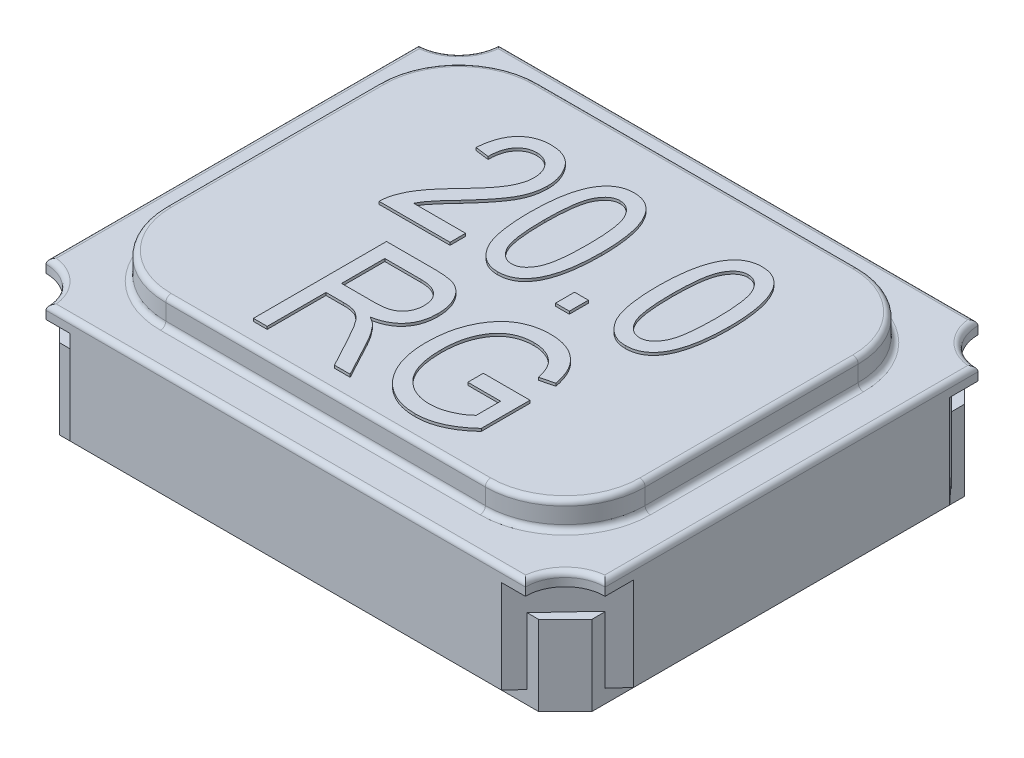
from build123d import *

# Parameters (mm, degrees)
EXTRUDE_2_DEPTH   = 0.05
EXTRUDE_2_2_DEPTH = 0.05
EXTRUDE_2_3_DEPTH = 0.05
EXTRUDE_2_4_DEPTH = 0.05
EXTRUDE_4_DEPTH   = 0.25
EXTRUDE_6_DEPTH   = 0.35
EXTRUDE_9_DEPTH   = 0.05
SKETCH_6_W        = 1.8
SKETCH_6_H        = 1.4
EXTRUDE_10_DEPTH  = 0.1
FILLET_2_R        = 0.3
FILLET_3_R        = 0.02
SKETCH_7_W        = 0.051948052
SKETCH_7_H        = 0.071428571
EXTRUDE_11_DEPTH  = 0.01


with BuildPart() as part:
    # Эскиз2 → Вытянуть2 (new body)
    with BuildSketch(Plane(origin=(0, 0, 0), x_dir=(1, 0, 0), z_dir=(0, 1, 0))):
        Polygon((-1, 0.25), (-0.35, 0.25), (-0.35, 0.8), (-0.9, 0.8), (-1, 0.7), align=None)
    extrude(amount=EXTRUDE_2_DEPTH)



with BuildPart() as body_2:
    # Эскиз2 → Extrude 2 2 (new body)
    with BuildSketch(Plane(origin=(0, 0, 0), x_dir=(1, 0, 0), z_dir=(0, 1, 0))):
        Polygon((0.35, 0.25), (0.35, 0.8), (0.9, 0.8), (1, 0.7), (1, 0.25), align=None)
    extrude(amount=EXTRUDE_2_2_DEPTH)


with BuildPart() as body_3:
    # Эскиз2 → Extrude 2 3 (new body)
    with BuildSketch(Plane(origin=(0, 0, 0), x_dir=(1, 0, 0), z_dir=(0, 1, 0))):
        Polygon((-1, -0.7), (-1, -0.25), (-0.484, -0.25), (-0.35, -0.363384615), (-0.35, -0.8), (-0.9, -0.8), align=None)
    extrude(amount=EXTRUDE_2_3_DEPTH)


with BuildPart() as body_4:
    # Эскиз2 → Extrude 2 4 (new body)
    with BuildSketch(Plane(origin=(0, 0, 0), x_dir=(1, 0, 0), z_dir=(0, 1, 0))):
        Polygon((1, -0.25), (0.35, -0.25), (0.35, -0.8), (0.9, -0.8), (1, -0.7), align=None)
    extrude(amount=EXTRUDE_2_4_DEPTH)


with BuildPart() as part_1:
    add(part.part)

    add(body_2.part)  # Вытянуть4 merges body 2

    add(body_3.part)  # Вытянуть4 merges body 3

    add(body_4.part)  # Вытянуть4 merges body 4
    # Эскиз3 → Вытянуть4 (add)
    with BuildSketch(Plane(origin=(-0.35, 0.05, 0.8), x_dir=(-1, 0, 0), z_dir=(0, 1, 0))):
        Polygon((0.65, -1.5), (0.55, -1.6), (0.5, -1.6), (0.65, -1.45), align=None)
        Polygon((-1.35, -1.45), (-1.35, -1.5), (-1.25, -1.6), (-1.2, -1.6), align=None)
        Polygon((-1.35, -0.1), (-1.25, 0), (-1.2, 0), (-1.35, -0.15), align=None)
        Polygon((0.65, -0.15), (0.65, -0.1), (0.55, 0), (0.5, 0), align=None)
    extrude(amount=EXTRUDE_4_DEPTH)


with BuildPart() as body_2_2:
    # Эскиз4 → Вытянуть6 (new body)
    with BuildSketch(Plane(origin=(-0.35, 0.05, 0.8), x_dir=(-1, 0, 0), z_dir=(0, 1, 0))):
        Polygon((0.46, -1.65), (-1.16, -1.65), (-1.4, -1.393609781), (-1.4, -0.206390219), (-1.16, 0.05), (0.46, 0.05), (0.7, -0.206390219), (0.7, -1.393609781), align=None)
    extrude(amount=EXTRUDE_6_DEPTH)

    # Эскиз5 → Вытянуть9 (add)
    with BuildSketch(Plane(origin=(0, 0.4, 0.85), x_dir=(-1, 0, 0), z_dir=(0, 1, 0))):
        with BuildLine():
            Line((0.9, -1.7), (-0.9, -1.7))
            ThreePointArc((-0.9, -1.7), (-0.943933983, -1.593933983), (-1.05, -1.55))
            Line((-1.05, -1.55), (-1.05, -0.15))
            ThreePointArc((-1.05, -0.15), (-0.943933983, -0.106066017), (-0.9, 0))
            Line((-0.9, 0), (0.9, 0))
            ThreePointArc((0.9, 0), (0.943933983, -0.106066017), (1.05, -0.15))
            Line((1.05, -0.15), (1.05, -1.55))
            ThreePointArc((1.05, -1.55), (0.943933983, -1.593933983), (0.9, -1.7))
        make_face()
    extrude(amount=EXTRUDE_9_DEPTH)

    # Эскиз6 → Вытянуть10 (add)
    with BuildSketch(Plane(origin=(0, 0.45, 0), x_dir=(1, 0, 0), z_dir=(0, 1, 0))):
        Rectangle(SKETCH_6_W, SKETCH_6_H)
    extrude(amount=EXTRUDE_10_DEPTH)

    # Скругление2
    fillet_2_edges = [body_2_2.edges().sort_by_distance(p)[0] for p in [
        (-0.9, 0.5, -0.7),
        (-0.9, 0.5, 0.7),
        (0.9, 0.5, 0.7),
        (0.9, 0.5, -0.7),
    ]]
    fillet(fillet_2_edges, radius=FILLET_2_R)

    # Скругление3
    fillet_3_edges = [body_2_2.edges().sort_by_distance(p)[0] for p in [
        (-0.943933983, 0.45, 0.743933983),
        (0, 0.45, 0.85),
        (0.943933983, 0.45, 0.743933983),
        (1.05, 0.45, 0),
        (0.943933983, 0.45, -0.743933983),
        (0, 0.45, -0.85),
        (-0.943933983, 0.45, -0.743933983),
        (-1.05, 0.45, 0),
        (0, 0.45, -0.7),
        (0, 0.55, -0.7),
        (0.9, 0.45, 0),
        (0.9, 0.55, 0),
        (-0.9, 0.55, 0),
        (0, 0.55, 0.7),
        (-0.812132034, 0.55, 0.612132034),
        (-0.812132034, 0.55, -0.612132034),
        (0.812132034, 0.55, 0.612132034),
        (0.812132034, 0.55, -0.612132034),
        (0, 0.45, 0.7),
        (-0.9, 0.45, 0),
        (0.812132034, 0.45, -0.612132034),
        (0.812132034, 0.45, 0.612132034),
        (-0.812132034, 0.45, -0.612132034),
        (-0.812132034, 0.45, 0.612132034),
    ]]
    fillet(fillet_3_edges, radius=FILLET_3_R)

    # Эскиз7 → Вытянуть11 (add)
    # profile 1 of 6: a face of its own
    with BuildSketch(Plane(origin=(0, 0.55, 0), x_dir=(-1, 0, 0), z_dir=(0, 1, 0))):
        with BuildLine():
            Line((0.232671519, -0.058441558), (0.232671519, 0))
            Line((0.232671519, 0), (0.498905285, 0))
            add(Edge.make_bspline(
                [(0.498905285, 0), (0.498917612, -0.00304505), (0.498942586, -0.00921437), (0.49811227, -0.018620044), (0.496406314, -0.028253434), (0.494227981, -0.038243051), (0.491139349, -0.048457517), (0.487358262, -0.058946435), (0.482897028, -0.069683799), (0.477672865, -0.080732774), (0.471570065, -0.092201076), (0.464197802, -0.104033552), (0.455773301, -0.11645002), (0.446092454, -0.129295645), (0.435329427, -0.142692521), (0.423431106, -0.156578601), (0.410447182, -0.171030183), (0.401194672, -0.180628905), (0.396429636, -0.18557224)],
                knots=[0, 0, 0, 0, 0.672196011, 1.361880106, 2.081368845, 2.831486093, 3.618364569, 4.435734711, 5.292876118, 6.184871288, 7.133796945, 8.159796293, 9.26180684, 10.446293416, 11.710635831, 13.056147575, 14.483918136, 16, 16, 16, 16], degree=3))
            add(Edge.make_bspline(
                [(0.396429636, -0.18557224), (0.390892589, -0.191298767), (0.380231437, -0.20232475), (0.365232169, -0.218609445), (0.351585097, -0.233731191), (0.33963091, -0.248043769), (0.328917483, -0.261113943), (0.319849175, -0.273362766), (0.312230175, -0.284547289), (0.304203757, -0.297877238), (0.29646293, -0.31365476), (0.289833046, -0.332138627), (0.285407707, -0.349934345), (0.284877169, -0.361685004), (0.284619571, -0.367390422)],
                knots=[0, 0, 0, 0, 1.312411154, 2.526945595, 3.64776648, 4.668054202, 5.599250703, 6.431783916, 7.178281792, 7.828133401, 8.994463432, 10.06613924, 11.061032878, 12, 12, 12, 12], degree=3))
            add(Edge.make_bspline(
                [(0.284619571, -0.367390422), (0.284654675, -0.370540165), (0.284723237, -0.376691941), (0.285941625, -0.385669869), (0.287601636, -0.394241654), (0.290070092, -0.402340236), (0.29307985, -0.410071276), (0.297008451, -0.417248033), (0.301435, -0.424103497), (0.30662006, -0.430356937), (0.312282721, -0.43600005), (0.318266049, -0.441051519), (0.324669369, -0.445180494), (0.331361117, -0.448600611), (0.338381281, -0.451217493), (0.345712151, -0.453178261), (0.353376168, -0.454292181), (0.358581229, -0.454460193), (0.361222655, -0.454545455)],
                knots=[0, 0, 0, 0, 1.164230772, 2.273864494, 3.346188882, 4.391230338, 5.401926325, 6.409519631, 7.412440917, 8.416921958, 9.407829897, 10.36743554, 11.307926244, 12.220023309, 13.142615873, 14.07432652, 15.022773578, 16, 16, 16, 16], degree=3))
            add(Edge.make_bspline(
                [(0.361222655, -0.454545455), (0.364070576, -0.454485797), (0.369629849, -0.454369343), (0.377731994, -0.452918788), (0.385498639, -0.450984378), (0.392832144, -0.447978086), (0.399826512, -0.444195094), (0.406371091, -0.439528792), (0.412563112, -0.434056502), (0.41831312, -0.427772385), (0.423615073, -0.420724905), (0.428046819, -0.412793843), (0.431962859, -0.404233322), (0.435043369, -0.39489877), (0.437518278, -0.384860919), (0.439155639, -0.374093936), (0.440361632, -0.362615034), (0.440429069, -0.354711267), (0.440463727, -0.350649351)],
                knots=[0, 0, 0, 0, 0.928796924, 1.81305423, 2.681021375, 3.538312184, 4.39332334, 5.272808506, 6.156996835, 7.087171748, 8.050270225, 9.029757968, 10.048018956, 11.120254801, 12.234609712, 13.420296851, 14.674234959, 16, 16, 16, 16], degree=3))
            Line((0.440463727, -0.350649351), (0.492411779, -0.357142857))
            add(Edge.make_bspline(
                [(0.492411779, -0.357142857), (0.49187644, -0.363171023), (0.490837859, -0.374865938), (0.488112699, -0.391796024), (0.484331799, -0.407504545), (0.479841157, -0.42214625), (0.474200113, -0.435546182), (0.467851001, -0.447949676), (0.46042633, -0.45914099), (0.452081119, -0.469138882), (0.442885298, -0.47790569), (0.433006074, -0.485525178), (0.422489934, -0.492133469), (0.411188866, -0.497379056), (0.399177627, -0.501469163), (0.386500985, -0.504393413), (0.373108184, -0.506137389), (0.363967338, -0.506373047), (0.359294896, -0.506493506)],
                knots=[0, 0, 0, 0, 1.296016433, 2.514330702, 3.668705393, 4.754684394, 5.790583066, 6.778804856, 7.735156204, 8.660808185, 9.562568342, 10.450784178, 11.329227516, 12.217177451, 13.112894374, 14.042449809, 14.999377131, 16, 16, 16, 16], degree=3))
            add(Edge.make_bspline(
                [(0.359294896, -0.506493506), (0.354249699, -0.506346514), (0.344425863, -0.506060296), (0.33013219, -0.504145282), (0.316760971, -0.500844453), (0.304409121, -0.49599124), (0.292942356, -0.49003096), (0.282464384, -0.48262852), (0.272986119, -0.473828195), (0.264558803, -0.463796511), (0.257109134, -0.452970885), (0.250609353, -0.44164975), (0.244971173, -0.430022221), (0.240564811, -0.41795851), (0.236885019, -0.405620629), (0.234573296, -0.392821522), (0.232945859, -0.379708876), (0.232763482, -0.370845267), (0.232671519, -0.366375812)],
                knots=[0, 0, 0, 0, 1.141316638, 2.222333051, 3.255980828, 4.24919085, 5.217781249, 6.173073686, 7.14226832, 8.135684626, 9.131102602, 10.111468148, 11.086834621, 12.050425614, 13.014198859, 13.995608887, 14.989290351, 16, 16, 16, 16], degree=3))
            add(Edge.make_bspline(
                [(0.232671519, -0.366375812), (0.232757917, -0.36234895), (0.232929586, -0.354347691), (0.234053205, -0.342410744), (0.236016172, -0.330628762), (0.238633429, -0.318924457), (0.242077357, -0.307358632), (0.246390642, -0.295967255), (0.251372193, -0.284690069), (0.257142514, -0.273311282), (0.264092567, -0.261579793), (0.272343802, -0.249103288), (0.282017543, -0.23574705), (0.292992876, -0.221446855), (0.305286603, -0.206205919), (0.319006401, -0.190085058), (0.334125017, -0.17306482), (0.344767389, -0.161509067), (0.350264863, -0.155539773)],
                knots=[0, 0, 0, 0, 0.780472836, 1.550777384, 2.321277132, 3.094115446, 3.873899828, 4.657970281, 5.45330333, 6.262401287, 7.129160449, 8.094534006, 9.160566029, 10.324774858, 11.58803391, 12.955259569, 14.427194379, 16, 16, 16, 16], degree=3))
            add(Edge.make_bspline(
                [(0.350264863, -0.155539773), (0.353758377, -0.151828815), (0.360434764, -0.144736877), (0.36982518, -0.134449828), (0.378429997, -0.125224118), (0.385956729, -0.116826206), (0.392649779, -0.109435964), (0.398151375, -0.102811532), (0.402881809, -0.097275637), (0.409782828, -0.088404781), (0.418492158, -0.075892041), (0.424550928, -0.06412424), (0.427476714, -0.058441558)],
                knots=[0, 0, 0, 0, 1.227426371, 2.345710398, 3.354421158, 4.265580894, 5.061720194, 5.755250507, 6.339260457, 6.815034732, 8.461977265, 10, 10, 10, 10], degree=3))
            Line((0.427476714, -0.058441558), (0.232671519, -0.058441558))
        make_face()
    # profile 2 of 6: a face of its own
    with BuildSketch(Plane(origin=(0, 0.55, 0), x_dir=(-1, 0, 0), z_dir=(0, 1, 0))):
        with BuildLine():
            add(Edge.make_bspline(
                [(0.180723467, -0.249797078), (0.180640986, -0.260013151), (0.180480827, -0.279850309), (0.178825266, -0.308621794), (0.176214676, -0.335500992), (0.17266229, -0.360450794), (0.167862398, -0.383478546), (0.162176423, -0.404639838), (0.155274645, -0.423875391), (0.147415171, -0.441200763), (0.138496632, -0.456548565), (0.128488856, -0.469870509), (0.117535364, -0.48127606), (0.105411725, -0.490529621), (0.092303491, -0.497705198), (0.07818326, -0.502835572), (0.063062408, -0.505939473), (0.052626772, -0.506306327), (0.047302201, -0.506493506)],
                knots=[0, 0, 0, 0, 1.522177082, 2.955701814, 4.292601031, 5.54555501, 6.7088804, 7.795771162, 8.808034672, 9.750647735, 10.627079958, 11.44753433, 12.228026558, 12.97593222, 13.711165822, 14.446140298, 15.20717461, 16, 16, 16, 16], degree=3))
            add(Edge.make_bspline(
                [(0.047302201, -0.506493506), (0.042554112, -0.506356036), (0.033223818, -0.506085899), (0.019676077, -0.503410961), (0.006829687, -0.499423323), (-0.005128517, -0.493538576), (-0.016333839, -0.48604567), (-0.026653133, -0.476828075), (-0.036353411, -0.46608203), (-0.041876669, -0.457933128), (-0.044722962, -0.453733766)],
                knots=[0, 0, 0, 0, 1.02455918, 2.013323352, 2.972239719, 3.92313388, 4.881632631, 5.875512573, 6.905191138, 8, 8, 8, 8], degree=3))
            add(Edge.make_bspline(
                [(-0.044722962, -0.453733766), (-0.048028121, -0.448082969), (-0.05490155, -0.436331541), (-0.063093018, -0.416638601), (-0.070075917, -0.394635791), (-0.07565398, -0.370218052), (-0.080075893, -0.343482261), (-0.083285648, -0.314391147), (-0.085214361, -0.282899748), (-0.085409287, -0.261095938), (-0.085510299, -0.249797078)],
                knots=[0, 0, 0, 0, 0.745775943, 1.550919754, 2.425386613, 3.375801173, 4.404149056, 5.513981972, 6.711731112, 8, 8, 8, 8], degree=3))
            add(Edge.make_bspline(
                [(-0.085510299, -0.249797078), (-0.085428567, -0.239648513), (-0.085269894, -0.219946282), (-0.083603146, -0.191345463), (-0.081017425, -0.164596819), (-0.077394399, -0.139736653), (-0.072811074, -0.11673598), (-0.06700422, -0.095661638), (-0.060297185, -0.076405623), (-0.052374339, -0.059083715), (-0.043478563, -0.043668697), (-0.033550189, -0.030232427), (-0.022451615, -0.018942998), (-0.010443927, -0.00954879), (0.002759204, -0.002404921), (0.016876914, 0.002848039), (0.032084913, 0.005940777), (0.042553196, 0.006306385), (0.047910967, 0.006493506)],
                knots=[0, 0, 0, 0, 1.513837482, 2.938935398, 4.272350439, 5.521752746, 6.68539866, 7.768673685, 8.780403913, 9.72410058, 10.605895827, 11.431327849, 12.209109083, 12.960945015, 13.697023823, 14.439318735, 15.201227913, 16, 16, 16, 16], degree=3))
            add(Edge.make_bspline(
                [(0.047910967, 0.006493506), (0.052690424, 0.006312367), (0.062087376, 0.005956227), (0.075856407, 0.003304879), (0.088868573, -0.001404232), (0.101336743, -0.007642189), (0.112961271, -0.015954685), (0.124054532, -0.025838873), (0.134218964, -0.037768208), (0.144036478, -0.051337354), (0.152793354, -0.067253597), (0.160377584, -0.085663078), (0.1667005, -0.106676674), (0.17178576, -0.130303922), (0.175777874, -0.156499133), (0.178692058, -0.185280282), (0.180378593, -0.216666701), (0.180605506, -0.238465164), (0.180723467, -0.249797078)],
                knots=[0, 0, 0, 0, 0.713939269, 1.403684939, 2.084525483, 2.776045801, 3.479790818, 4.213328499, 4.990539752, 5.816442109, 6.712155869, 7.697513436, 8.78604652, 9.986360954, 11.305640346, 12.743160741, 14.306934742, 16, 16, 16, 16], degree=3))
        make_face()
        with BuildLine():
            add(Edge.make_bspline(
                [(0.128775415, -0.25), (0.128683823, -0.240259105), (0.128508536, -0.221617308), (0.127569462, -0.194913542), (0.12575582, -0.170748876), (0.123272565, -0.149074759), (0.120081146, -0.129892578), (0.116234898, -0.113164193), (0.111515106, -0.098988345), (0.106075208, -0.087117323), (0.099950488, -0.077255722), (0.093575592, -0.068752941), (0.086757501, -0.061562079), (0.079476194, -0.05571324), (0.071827452, -0.051057517), (0.063709867, -0.047784602), (0.055179529, -0.045769006), (0.049342463, -0.045560197), (0.046389051, -0.045454545)],
                knots=[0, 0, 0, 0, 1.930680258, 3.694870612, 5.294765573, 6.732327541, 8.017244644, 9.14720992, 10.130763445, 10.973463911, 11.728776188, 12.427251247, 13.076760965, 13.687074849, 14.273357039, 14.844695938, 15.415444712, 16, 16, 16, 16], degree=3))
            add(Edge.make_bspline(
                [(0.046389051, -0.045454545), (0.04360127, -0.045550442), (0.038050352, -0.045741386), (0.029962995, -0.047942697), (0.022176254, -0.051131009), (0.014831053, -0.055880545), (0.007870115, -0.0618819), (0.001230526, -0.069196898), (-0.005051211, -0.077765836), (-0.011039403, -0.087762618), (-0.016537305, -0.099677068), (-0.021060805, -0.11397351), (-0.025004676, -0.130656093), (-0.028016434, -0.149798316), (-0.030557272, -0.171354802), (-0.032348897, -0.195387848), (-0.033296147, -0.22188756), (-0.033471004, -0.240360473), (-0.033562247, -0.25)],
                knots=[0, 0, 0, 0, 0.5561996, 1.107481919, 1.665324653, 2.233973471, 2.848122302, 3.499305928, 4.205575626, 4.970121907, 5.826722289, 6.823612291, 7.963984009, 9.252947287, 10.697030014, 12.304913753, 14.07183163, 16, 16, 16, 16], degree=3))
            add(Edge.make_bspline(
                [(-0.033562247, -0.25), (-0.033469883, -0.259740853), (-0.033292799, -0.278416363), (-0.032361359, -0.305154447), (-0.030534526, -0.32938541), (-0.0280685, -0.351095568), (-0.02486641, -0.37030971), (-0.021024447, -0.387040439), (-0.016294185, -0.401209465), (-0.010897308, -0.41307476), (-0.004694761, -0.422849766), (0.00159717, -0.431384203), (0.008597034, -0.438442005), (0.01592366, -0.444261249), (0.023610301, -0.44896955), (0.031841853, -0.452230141), (0.040510423, -0.454221496), (0.046446239, -0.454437015), (0.049432883, -0.454545455)],
                knots=[0, 0, 0, 0, 1.926017154, 3.692628624, 5.288659415, 6.729390826, 8.011204514, 9.138440624, 10.119618606, 10.960283728, 11.708082919, 12.404870975, 13.05267392, 13.666742433, 14.251608596, 14.827770794, 15.41018532, 16, 16, 16, 16], degree=3))
            add(Edge.make_bspline(
                [(0.049432883, -0.454545455), (0.052220235, -0.454450233), (0.057737444, -0.454261754), (0.065740335, -0.452086897), (0.073400943, -0.448785377), (0.080734621, -0.444182768), (0.087676383, -0.438210563), (0.094186521, -0.430898484), (0.100354987, -0.422304279), (0.106383128, -0.412320353), (0.111823866, -0.400388133), (0.116272241, -0.386082368), (0.120198985, -0.369403826), (0.123390042, -0.350253043), (0.125719149, -0.328634912), (0.127577986, -0.304614132), (0.128504738, -0.278111871), (0.128682602, -0.259639332), (0.128775415, -0.25)],
                knots=[0, 0, 0, 0, 0.557130238, 1.102768586, 1.649079731, 2.224414864, 2.830037934, 3.477754783, 4.181203309, 4.947028836, 5.811221183, 6.801235864, 7.943515661, 9.242435973, 10.688157038, 12.298731102, 14.068605401, 16, 16, 16, 16], degree=3))
        make_face(mode=Mode.SUBTRACT)
    # profile 3 of 6: a face of its own
    with BuildSketch(Plane(origin=(0, 0.55, 0), x_dir=(-1, 0, 0), z_dir=(0, 1, 0))):
        with Locations((-0.189406403, -0.035714286)):
            Rectangle(SKETCH_7_W, SKETCH_7_H)
    # profile 4 of 6: a face of its own
    with BuildSketch(Plane(origin=(0, 0.55, 0), x_dir=(-1, 0, 0), z_dir=(0, 1, 0))):
        with BuildLine():
            add(Edge.make_bspline(
                [(-0.299796014, -0.249797078), (-0.299878495, -0.260013151), (-0.300038653, -0.279850309), (-0.301694214, -0.308621794), (-0.304304804, -0.335500992), (-0.30785719, -0.360450794), (-0.312657083, -0.383478546), (-0.318343057, -0.404639838), (-0.325244836, -0.423875391), (-0.333104309, -0.441200763), (-0.342022848, -0.456548565), (-0.352030624, -0.469870509), (-0.362984116, -0.48127606), (-0.375107755, -0.490529621), (-0.38821599, -0.497705198), (-0.402336221, -0.502835572), (-0.417457072, -0.505939473), (-0.427892708, -0.506306327), (-0.43321728, -0.506493506)],
                knots=[0, 0, 0, 0, 1.522177082, 2.955701814, 4.292601031, 5.54555501, 6.7088804, 7.795771162, 8.808034672, 9.750647735, 10.627079958, 11.44753433, 12.228026558, 12.97593222, 13.711165822, 14.446140298, 15.20717461, 16, 16, 16, 16], degree=3))
            add(Edge.make_bspline(
                [(-0.43321728, -0.506493506), (-0.437965369, -0.506356036), (-0.447295662, -0.506085899), (-0.460843403, -0.503410961), (-0.473689793, -0.499423323), (-0.485647998, -0.493538576), (-0.49685332, -0.48604567), (-0.507172614, -0.476828075), (-0.516872891, -0.46608203), (-0.52239615, -0.457933128), (-0.525242442, -0.453733766)],
                knots=[0, 0, 0, 0, 1.02455918, 2.013323352, 2.972239719, 3.92313388, 4.881632631, 5.875512573, 6.905191138, 8, 8, 8, 8], degree=3))
            add(Edge.make_bspline(
                [(-0.525242442, -0.453733766), (-0.528547602, -0.448082969), (-0.535421031, -0.436331541), (-0.543612499, -0.416638601), (-0.550595398, -0.394635791), (-0.556173461, -0.370218052), (-0.560595373, -0.343482261), (-0.563805129, -0.314391147), (-0.565733842, -0.282899748), (-0.565928768, -0.261095938), (-0.56602978, -0.249797078)],
                knots=[0, 0, 0, 0, 0.745775943, 1.550919754, 2.425386613, 3.375801173, 4.404149056, 5.513981972, 6.711731112, 8, 8, 8, 8], degree=3))
            add(Edge.make_bspline(
                [(-0.56602978, -0.249797078), (-0.565948048, -0.239648513), (-0.565789374, -0.219946282), (-0.564122626, -0.191345463), (-0.561536905, -0.164596819), (-0.557913879, -0.139736653), (-0.553330554, -0.11673598), (-0.5475237, -0.095661638), (-0.540816665, -0.076405623), (-0.532893819, -0.059083715), (-0.523998044, -0.043668697), (-0.51406967, -0.030232427), (-0.502971095, -0.018942998), (-0.490963408, -0.00954879), (-0.477760276, -0.002404921), (-0.463642566, 0.002848039), (-0.448434568, 0.005940777), (-0.437966284, 0.006306385), (-0.432608514, 0.006493506)],
                knots=[0, 0, 0, 0, 1.513837482, 2.938935398, 4.272350439, 5.521752746, 6.68539866, 7.768673685, 8.780403913, 9.72410058, 10.605895827, 11.431327849, 12.209109083, 12.960945015, 13.697023823, 14.439318735, 15.201227913, 16, 16, 16, 16], degree=3))
            add(Edge.make_bspline(
                [(-0.432608514, 0.006493506), (-0.427829056, 0.006312367), (-0.418432105, 0.005956227), (-0.404663073, 0.003304879), (-0.391650908, -0.001404232), (-0.379182738, -0.007642189), (-0.367558209, -0.015954685), (-0.356464949, -0.025838873), (-0.346300516, -0.037768208), (-0.336483002, -0.051337354), (-0.327726127, -0.067253597), (-0.320141896, -0.085663078), (-0.313818981, -0.106676674), (-0.308733721, -0.130303922), (-0.304741607, -0.156499133), (-0.301827423, -0.185280282), (-0.300140887, -0.216666701), (-0.299913974, -0.238465164), (-0.299796014, -0.249797078)],
                knots=[0, 0, 0, 0, 0.713939269, 1.403684939, 2.084525483, 2.776045801, 3.479790818, 4.213328499, 4.990539752, 5.816442109, 6.712155869, 7.697513436, 8.78604652, 9.986360954, 11.305640346, 12.743160741, 14.306934742, 16, 16, 16, 16], degree=3))
        make_face()
        with BuildLine():
            add(Edge.make_bspline(
                [(-0.351744065, -0.25), (-0.351835658, -0.240259105), (-0.352010945, -0.221617308), (-0.352950019, -0.194913542), (-0.354763661, -0.170748876), (-0.357246916, -0.149074759), (-0.360438335, -0.129892578), (-0.364284582, -0.113164193), (-0.369004375, -0.098988345), (-0.374444273, -0.087117323), (-0.380568992, -0.077255722), (-0.386943889, -0.068752941), (-0.393761979, -0.061562079), (-0.401043286, -0.05571324), (-0.408692029, -0.051057517), (-0.416809614, -0.047784602), (-0.425339952, -0.045769006), (-0.431177018, -0.045560197), (-0.434130429, -0.045454545)],
                knots=[0, 0, 0, 0, 1.930680258, 3.694870612, 5.294765573, 6.732327541, 8.017244644, 9.14720992, 10.130763445, 10.973463911, 11.728776188, 12.427251247, 13.076760965, 13.687074849, 14.273357039, 14.844695938, 15.415444712, 16, 16, 16, 16], degree=3))
            add(Edge.make_bspline(
                [(-0.434130429, -0.045454545), (-0.436918211, -0.045550442), (-0.442469128, -0.045741386), (-0.450556486, -0.047942697), (-0.458343227, -0.051131009), (-0.465688427, -0.055880545), (-0.472649366, -0.0618819), (-0.479288955, -0.069196898), (-0.485570692, -0.077765836), (-0.491558884, -0.087762618), (-0.497056786, -0.099677068), (-0.501580286, -0.11397351), (-0.505524156, -0.130656093), (-0.508535915, -0.149798316), (-0.511076753, -0.171354802), (-0.512868377, -0.195387848), (-0.513815628, -0.22188756), (-0.513990484, -0.240360473), (-0.514081728, -0.25)],
                knots=[0, 0, 0, 0, 0.5561996, 1.107481919, 1.665324653, 2.233973471, 2.848122302, 3.499305928, 4.205575626, 4.970121907, 5.826722289, 6.823612291, 7.963984009, 9.252947287, 10.697030014, 12.304913753, 14.07183163, 16, 16, 16, 16], degree=3))
            add(Edge.make_bspline(
                [(-0.514081728, -0.25), (-0.513989363, -0.259740853), (-0.513812279, -0.278416363), (-0.512880839, -0.305154447), (-0.511054007, -0.32938541), (-0.50858798, -0.351095568), (-0.50538589, -0.37030971), (-0.501543928, -0.387040439), (-0.496813665, -0.401209465), (-0.491416788, -0.41307476), (-0.485214241, -0.422849766), (-0.47892231, -0.431384203), (-0.471922447, -0.438442005), (-0.464595821, -0.444261249), (-0.45690918, -0.44896955), (-0.448677627, -0.452230141), (-0.440009058, -0.454221496), (-0.434073242, -0.454437015), (-0.431086598, -0.454545455)],
                knots=[0, 0, 0, 0, 1.926017154, 3.692628624, 5.288659415, 6.729390826, 8.011204514, 9.138440624, 10.119618606, 10.960283728, 11.708082919, 12.404870975, 13.05267392, 13.666742433, 14.251608596, 14.827770794, 15.41018532, 16, 16, 16, 16], degree=3))
            add(Edge.make_bspline(
                [(-0.431086598, -0.454545455), (-0.428299246, -0.454450233), (-0.422782036, -0.454261754), (-0.414779146, -0.452086897), (-0.407118538, -0.448785377), (-0.399784859, -0.444182768), (-0.392843098, -0.438210563), (-0.38633296, -0.430898484), (-0.380164494, -0.422304279), (-0.374136353, -0.412320353), (-0.368695615, -0.400388133), (-0.364247239, -0.386082368), (-0.360320496, -0.369403826), (-0.357129438, -0.350253043), (-0.354800332, -0.328634912), (-0.352941494, -0.304614132), (-0.352014743, -0.278111871), (-0.351836878, -0.259639332), (-0.351744065, -0.25)],
                knots=[0, 0, 0, 0, 0.557130238, 1.102768586, 1.649079731, 2.224414864, 2.830037934, 3.477754783, 4.181203309, 4.947028836, 5.811221183, 6.801235864, 7.943515661, 9.242435973, 10.688157038, 12.298731102, 14.068605401, 16, 16, 16, 16], degree=3))
        make_face(mode=Mode.SUBTRACT)
    # profile 5 of 6: a face of its own
    with BuildSketch(Plane(origin=(0, 0.55, 0), x_dir=(-1, 0, 0), z_dir=(0, 1, 0))):
        with BuildLine():
            Line((0.354545455, 0.6167292), (0.354545455, 0.1167292))
            Line((0.354545455, 0.1167292), (0.170900974, 0.1167292))
            add(Edge.make_bspline(
                [(0.170900974, 0.1167292), (0.166266399, 0.116755308), (0.157295702, 0.116805842), (0.144301982, 0.117556324), (0.132247356, 0.118626676), (0.121113608, 0.12017309), (0.110917815, 0.121992), (0.101690412, 0.124504585), (0.093358034, 0.127241317), (0.083550636, 0.131764077), (0.07244751, 0.138909239), (0.060373411, 0.149581414), (0.049837937, 0.162841185), (0.040454545, 0.178060158), (0.032750926, 0.195152064), (0.027293515, 0.21379054), (0.023999132, 0.233732232), (0.023587735, 0.247465791), (0.023376623, 0.254513291)],
                knots=[0, 0, 0, 0, 0.957635919, 1.853602921, 2.688875264, 3.457888691, 4.176190018, 4.827208561, 5.432822301, 5.986390625, 7.054747822, 8.148857704, 9.301562339, 10.541054864, 11.836189034, 13.163051712, 14.544194391, 16, 16, 16, 16], degree=3))
            add(Edge.make_bspline(
                [(0.023376623, 0.254513291), (0.023487381, 0.259183378), (0.023703725, 0.268305518), (0.025004512, 0.281677514), (0.027298918, 0.29438643), (0.030707842, 0.30636812), (0.034802149, 0.317734241), (0.040057196, 0.328330256), (0.046128427, 0.338309703), (0.053168277, 0.347589275), (0.061098273, 0.356104799), (0.069839111, 0.363904647), (0.07958968, 0.37066596), (0.090047531, 0.376793809), (0.101393885, 0.382081119), (0.113573121, 0.386544404), (0.126628103, 0.390074576), (0.135647731, 0.391813872), (0.14025974, 0.392703226)],
                knots=[0, 0, 0, 0, 1.121876415, 2.19137531, 3.223949102, 4.219388443, 5.180726412, 6.121767895, 7.055309798, 7.98310721, 8.914383918, 9.846793912, 10.791230962, 11.759648879, 12.755485972, 13.793860249, 14.871933835, 16, 16, 16, 16], degree=3))
            add(Edge.make_bspline(
                [(0.14025974, 0.392703226), (0.136838475, 0.394568166), (0.130334012, 0.398113764), (0.121638089, 0.404160059), (0.113877156, 0.409749764), (0.109605175, 0.414022853), (0.107589286, 0.416039265)],
                knots=[0, 0, 0, 0, 1.159130627, 2.203723279, 3.152361336, 4, 4, 4, 4], degree=3))
            add(Edge.make_bspline(
                [(0.107589286, 0.416039265), (0.103537547, 0.420929876), (0.095388509, 0.430766093), (0.084217474, 0.446458543), (0.073517094, 0.462783081), (0.067233327, 0.474266552), (0.0640625, 0.480061181)],
                knots=[0, 0, 0, 0, 0.982253192, 1.975551771, 2.978451105, 4, 4, 4, 4], degree=3))
            Line((0.0640625, 0.480061181), (-0.009090909, 0.6167292))
            Line((-0.009090909, 0.6167292), (0.049959416, 0.6167292))
            Line((0.049959416, 0.6167292), (0.107690747, 0.509789265))
            add(Edge.make_bspline(
                [(0.107690747, 0.509789265), (0.110379726, 0.504774728), (0.1155231, 0.495183117), (0.123162869, 0.48156859), (0.130242144, 0.469275905), (0.136835724, 0.458370702), (0.142756989, 0.448741722), (0.148393954, 0.440668894), (0.153312009, 0.433772284), (0.159221949, 0.426673724), (0.16639946, 0.419570607), (0.174637006, 0.412224463), (0.182929228, 0.406579752), (0.191356844, 0.402269587), (0.200637736, 0.399432732), (0.211094355, 0.397308511), (0.223195789, 0.3961533), (0.231775361, 0.396020621), (0.236343344, 0.395949979)],
                knots=[0, 0, 0, 0, 1.483494143, 2.837570132, 4.070207475, 5.181709378, 6.16033008, 7.016386932, 7.748320287, 8.368145667, 9.421904523, 10.378344883, 11.241682452, 12.030373519, 12.836277254, 13.763198992, 14.809069961, 16, 16, 16, 16], degree=3))
            Line((0.236343344, 0.395949979), (0.302597403, 0.395949979))
            Line((0.302597403, 0.395949979), (0.302597403, 0.6167292))
            Line((0.302597403, 0.6167292), (0.354545455, 0.6167292))
        make_face()
        with BuildLine():
            Line((0.302597403, 0.337508421), (0.180742695, 0.337508421))
            add(Edge.make_bspline(
                [(0.180742695, 0.337508421), (0.174482949, 0.337385743), (0.162751576, 0.337155832), (0.146335343, 0.33564691), (0.1323052, 0.332866758), (0.120407152, 0.32894283), (0.110321339, 0.323564535), (0.101535328, 0.316996264), (0.093669883, 0.309215445), (0.087180909, 0.300070622), (0.081790068, 0.289978255), (0.078129872, 0.27892282), (0.075642048, 0.267137392), (0.075432189, 0.258991112), (0.075324675, 0.254817674)],
                knots=[0, 0, 0, 0, 1.472846091, 2.760257298, 3.872921329, 4.831650159, 5.69663992, 6.549651953, 7.404887885, 8.288274496, 9.178088419, 10.086493483, 11.019687313, 12, 12, 12, 12], degree=3))
            add(Edge.make_bspline(
                [(0.075324675, 0.254817674), (0.075417113, 0.251805313), (0.075597323, 0.245932637), (0.07658175, 0.237326771), (0.07839775, 0.229235342), (0.080974586, 0.221629515), (0.084181997, 0.214524866), (0.088208558, 0.207918554), (0.092993572, 0.201873012), (0.098376883, 0.196238625), (0.104502329, 0.19119713), (0.111458788, 0.186998548), (0.119047865, 0.183281036), (0.127349847, 0.180278166), (0.136348959, 0.17792642), (0.146033653, 0.176367247), (0.156402018, 0.175300464), (0.163559026, 0.175214878), (0.167248377, 0.175170759)],
                knots=[0, 0, 0, 0, 1.044945206, 2.037148109, 2.998935724, 3.915084151, 4.817845283, 5.696903301, 6.590859038, 7.486736354, 8.395345577, 9.33279486, 10.298009282, 11.322143252, 12.388977231, 13.518936305, 14.721042082, 16, 16, 16, 16], degree=3))
            Line((0.167248377, 0.175170759), (0.302597403, 0.175170759))
            Line((0.302597403, 0.175170759), (0.302597403, 0.337508421))
        make_face(mode=Mode.SUBTRACT)
    # profile 6 of 6: a face of its own
    with BuildSketch(Plane(origin=(0, 0.55, 0), x_dir=(-1, 0, 0), z_dir=(0, 1, 0))):
        with BuildLine():
            Line((-0.255844156, 0.421924005), (-0.255844156, 0.363482447))
            Line((-0.255844156, 0.363482447), (-0.431168831, 0.363482447))
            Line((-0.431168831, 0.363482447), (-0.431168831, 0.546619622))
            add(Edge.make_bspline(
                [(-0.431168831, 0.546619622), (-0.424501552, 0.552687065), (-0.411452621, 0.564562019), (-0.390652739, 0.580061824), (-0.369642939, 0.593377073), (-0.348201649, 0.604217631), (-0.326417206, 0.612678914), (-0.304345844, 0.618836306), (-0.28190679, 0.622497267), (-0.26684889, 0.622980335), (-0.259293831, 0.623222707)],
                knots=[0, 0, 0, 0, 1.121231474, 2.194429093, 3.223167231, 4.213185939, 5.179199031, 6.126736477, 7.060120306, 8, 8, 8, 8], degree=3))
            add(Edge.make_bspline(
                [(-0.259293831, 0.623222707), (-0.254320147, 0.623106809), (-0.244457295, 0.622876983), (-0.229866869, 0.621605313), (-0.215678666, 0.619205425), (-0.20187928, 0.616041299), (-0.18856849, 0.61168199), (-0.175598091, 0.606663015), (-0.163112148, 0.600523677), (-0.151056406, 0.593521853), (-0.139443874, 0.585725316), (-0.128457856, 0.576964033), (-0.118110444, 0.567299817), (-0.108360583, 0.556814306), (-0.099159701, 0.545548471), (-0.090801273, 0.533276514), (-0.082805681, 0.520311695), (-0.075677816, 0.506400699), (-0.069132203, 0.491763097), (-0.063474039, 0.476372776), (-0.058715155, 0.460231374), (-0.054702779, 0.44341534), (-0.051878624, 0.425797375), (-0.049585695, 0.407532123), (-0.048257921, 0.388529337), (-0.048121392, 0.375625946), (-0.048051948, 0.369062804)],
                knots=[0, 0, 0, 0, 0.963769683, 1.911162165, 2.834339437, 3.749810782, 4.651221655, 5.545555403, 6.442286319, 7.343625743, 8.245036616, 9.149656848, 10.062991788, 10.985587531, 11.921948604, 12.878002728, 13.860173613, 14.871251345, 15.903800411, 16.965219181, 18.045343247, 19.162668582, 20.31206171, 21.500282558, 22.728551209, 24, 24, 24, 24], degree=3))
            add(Edge.make_bspline(
                [(-0.048051948, 0.369062804), (-0.048119779, 0.362397949), (-0.048253171, 0.34929136), (-0.049607125, 0.329955217), (-0.051825892, 0.311299343), (-0.054906655, 0.29325948), (-0.058642502, 0.27583487), (-0.063608685, 0.259138239), (-0.069274115, 0.243075474), (-0.075719957, 0.227714917), (-0.082936621, 0.213194937), (-0.090729389, 0.199607451), (-0.099050599, 0.186988973), (-0.107912721, 0.175344031), (-0.117335406, 0.16468912), (-0.127302673, 0.155016732), (-0.137786761, 0.146314192), (-0.148902567, 0.138720878), (-0.160492185, 0.131982078), (-0.172633452, 0.126224068), (-0.185202687, 0.121176996), (-0.198374045, 0.117290778), (-0.211982183, 0.11408971), (-0.226164725, 0.111924713), (-0.240828716, 0.110406403), (-0.250800895, 0.11029303), (-0.255844156, 0.110235694)],
                knots=[0, 0, 0, 0, 1.283113662, 2.523272143, 3.730000566, 4.899049828, 6.046110231, 7.158868481, 8.250466042, 9.324440243, 10.364107375, 11.3705106, 12.338577862, 13.272420617, 14.185809519, 15.074609769, 15.944238297, 16.80583268, 17.663628975, 18.52285769, 19.391095377, 20.268684501, 21.164328724, 22.080753496, 23.029373589, 24, 24, 24, 24], degree=3))
            add(Edge.make_bspline(
                [(-0.255844156, 0.110235694), (-0.263198345, 0.110394036), (-0.277509828, 0.110702176), (-0.298228715, 0.114148062), (-0.317659745, 0.119132227), (-0.335531033, 0.126684047), (-0.351932368, 0.136000734), (-0.366785895, 0.147201558), (-0.380166835, 0.160053213), (-0.390030292, 0.172220804), (-0.397158171, 0.182925054), (-0.402099846, 0.191813233), (-0.406793426, 0.201341297), (-0.411020714, 0.211636408), (-0.414972807, 0.222606962), (-0.418638703, 0.234273669), (-0.421866736, 0.246678561), (-0.423724524, 0.255216631), (-0.424675325, 0.259586343)],
                knots=[0, 0, 0, 0, 1.421356421, 2.766004312, 4.05319741, 5.293867224, 6.507164222, 7.69408069, 8.88335739, 10.08815607, 10.716053702, 11.369380072, 12.054125792, 12.769838882, 13.521154948, 14.309617137, 15.134876386, 16, 16, 16, 16], degree=3))
            Line((-0.424675325, 0.259586343), (-0.372727273, 0.272573356))
            add(Edge.make_bspline(
                [(-0.372727273, 0.272573356), (-0.371036829, 0.26618384), (-0.367854287, 0.254154514), (-0.36181657, 0.23760602), (-0.355386826, 0.223475522), (-0.347894967, 0.211756906), (-0.339423566, 0.201919211), (-0.329814141, 0.193491508), (-0.319031809, 0.186138824), (-0.307187121, 0.179829588), (-0.29425366, 0.174908316), (-0.28053311, 0.171220941), (-0.265990655, 0.169067823), (-0.25605421, 0.168809384), (-0.250974026, 0.168677252)],
                knots=[0, 0, 0, 0, 1.353165462, 2.547559122, 3.604316815, 4.52671073, 5.386326973, 6.255051103, 7.13704315, 8.05435008, 8.997377385, 9.965293206, 10.959720114, 12, 12, 12, 12], degree=3))
            add(Edge.make_bspline(
                [(-0.250974026, 0.168677252), (-0.247251549, 0.168726984), (-0.23992737, 0.168824835), (-0.229143546, 0.169857119), (-0.218747788, 0.171607675), (-0.208742781, 0.173914662), (-0.199079547, 0.176847556), (-0.18990535, 0.180607692), (-0.181112178, 0.185025621), (-0.172660149, 0.189975936), (-0.164587465, 0.195679989), (-0.156995254, 0.202213492), (-0.149730044, 0.209437645), (-0.142997098, 0.217478124), (-0.136524646, 0.226141445), (-0.130580089, 0.235601729), (-0.124966506, 0.245787891), (-0.119841515, 0.256708888), (-0.115128754, 0.268302514), (-0.111122994, 0.280554847), (-0.107649577, 0.293419521), (-0.104793879, 0.306895064), (-0.102746989, 0.321037768), (-0.101054719, 0.335782641), (-0.100180169, 0.35116108), (-0.10006067, 0.36162142), (-0.1, 0.366932122)],
                knots=[0, 0, 0, 0, 0.952677145, 1.874444928, 2.769688869, 3.649605989, 4.501257609, 5.351720294, 6.184145198, 7.018593555, 7.856940072, 8.710525669, 9.579816208, 10.476607676, 11.392584021, 12.346086896, 13.334140423, 14.368156984, 15.432428844, 16.53573995, 17.665599422, 18.842284706, 20.059330876, 21.322285137, 22.640527175, 24, 24, 24, 24], degree=3))
            add(Edge.make_bspline(
                [(-0.1, 0.366932122), (-0.100134216, 0.374918492), (-0.100394576, 0.390410886), (-0.102458181, 0.412881859), (-0.105716896, 0.433862343), (-0.110481423, 0.453275499), (-0.116528981, 0.471182813), (-0.124072061, 0.487493259), (-0.132875964, 0.502314559), (-0.143104787, 0.515466526), (-0.154392815, 0.527041746), (-0.166513041, 0.537117685), (-0.179365541, 0.545795683), (-0.193198423, 0.552649956), (-0.207747266, 0.558213627), (-0.223178298, 0.562048727), (-0.239409199, 0.564285348), (-0.250493482, 0.564613652), (-0.256148539, 0.564781148)],
                knots=[0, 0, 0, 0, 1.344504073, 2.608141831, 3.796174963, 4.916279424, 5.969770572, 6.973627265, 7.936561481, 8.86602944, 9.772106809, 10.653603516, 11.515946688, 12.376727864, 13.247174307, 14.133861134, 15.047920148, 16, 16, 16, 16], degree=3))
            add(Edge.make_bspline(
                [(-0.256148539, 0.564781148), (-0.26170632, 0.564605792), (-0.272993924, 0.56424965), (-0.289972678, 0.56127566), (-0.307107128, 0.556441807), (-0.324058797, 0.549923764), (-0.340216021, 0.542131594), (-0.355020884, 0.533560776), (-0.368026796, 0.524140979), (-0.37556698, 0.51707082), (-0.379220779, 0.513644785)],
                knots=[0, 0, 0, 0, 0.978162575, 1.986604247, 3.025534994, 4.109442341, 5.180230685, 6.181206173, 7.118654505, 8, 8, 8, 8], degree=3))
            Line((-0.379220779, 0.513644785), (-0.379220779, 0.421924005))
            Line((-0.379220779, 0.421924005), (-0.255844156, 0.421924005))
        make_face()
    extrude(amount=EXTRUDE_11_DEPTH)


solid = Compound([part_1.part, body_2_2.part])
